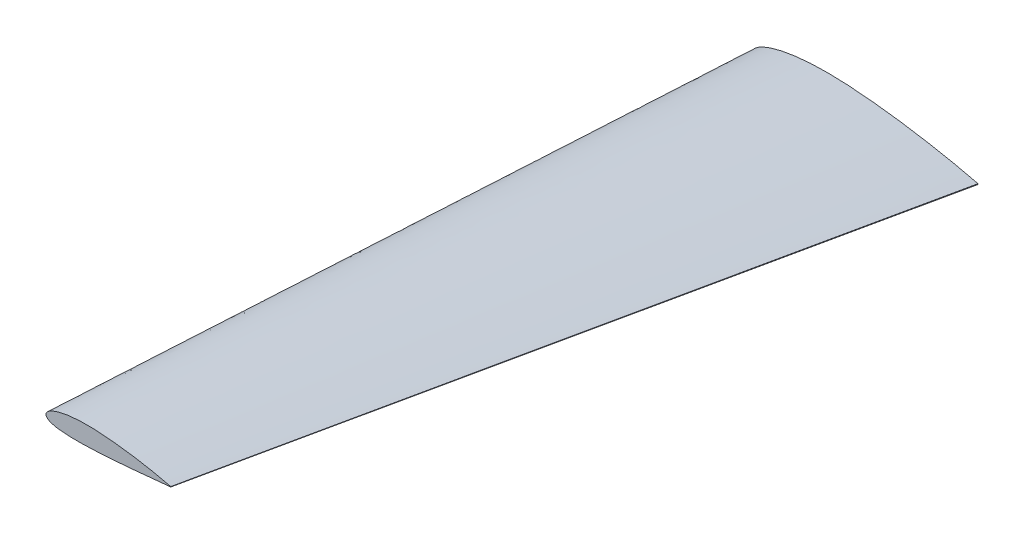
from build123d import *


with BuildPart() as part:
    # 1st airfoil → Loft2 section 0
    with BuildSketch(Plane.XY):
        with BuildLine():
            Line((1125.6, -0.909113568), (1125.6, -4.443091626))
            add(Edge.make_bspline(
                [(1125.6, -0.909113568), (1124.624936017, -0.660123834), (1120.62058284, 0.362417095), (1111.569252242, 2.505892261), (1096.550232752, 6.122404163), (1075.721387403, 10.965034412), (1049.309471361, 16.939316357), (1017.589841857, 23.876555702), (980.879432728, 31.523483854), (939.57587159, 39.738235439), (894.106329061, 48.253780275), (844.962049596, 56.883219356), (792.663181964, 65.38206179), (737.779875794, 73.55203211), (680.910182361, 81.166099133), (622.679833451, 88.004690437), (563.728429075, 93.887426627), (504.692395813, 98.561060411), (446.063199303, 101.961134933), (388.479078604, 103.549368042), (332.635559806, 103.11330405), (279.366346507, 100.626480887), (229.31295313, 96.166374749), (183.064756493, 89.803133409), (141.155847984, 81.769253747), (104.068602802, 72.2411645), (72.181897097, 61.558540548), (45.829346012, 49.93955445), (25.173564969, 37.690244008), (10.308778563, 24.94526832), (1.222733541, 11.491620122), (-1.022178786, -2.79241528), (4.007920171, -16.31516538), (15.408907008, -27.740831572), (32.187893722, -37.449608005), (54.309219424, -45.787931347), (81.638708838, -52.767249623), (113.938487706, -58.366325567), (150.884327322, -62.541572904), (192.096058356, -65.334420876), (237.152563597, -66.793342351), (285.607958385, -67.034221669), (336.977889113, -66.194115953), (390.753987563, -64.45804455), (446.578975057, -62.068229157), (503.890562489, -59.08726048), (562.074842401, -55.3454901), (620.33424818, -51.125842776), (678.030294929, -46.568607181), (734.532825698, -41.830786011), (789.227081447, -37.08318905), (841.506144564, -32.360371722), (890.794379398, -27.813553826), (936.539972629, -23.48333636), (978.226662529, -19.457033232), (1015.37920935, -15.809907167), (1047.574046904, -12.567814373), (1074.441639775, -9.810101231), (1095.674563553, -7.598624963), (1111.018994368, -5.993945559), (1120.335636801, -4.989664738), (1124.519509654, -4.55527366), (1125.6, -4.443091626)],
                knots=[0, 0, 0, 0, 0.001303345, 0.005352522, 0.012046339, 0.021311094, 0.033047622, 0.047117215, 0.063362508, 0.081612115, 0.101657457, 0.123273921, 0.14623252, 0.170277757, 0.195135791, 0.22054026, 0.24620839, 0.271859818, 0.29723365, 0.322260275, 0.346452958, 0.369543631, 0.391307276, 0.411513241, 0.429980367, 0.446542667, 0.461070389, 0.473485742, 0.483779539, 0.492063936, 0.498681588, 0.504376593, 0.510069863, 0.516664638, 0.524877655, 0.535024569, 0.547190471, 0.561360064, 0.577448521, 0.59532385, 0.614843137, 0.635823686, 0.658074561, 0.68137887, 0.705504986, 0.730440424, 0.755703478, 0.781015275, 0.806090941, 0.83065955, 0.854449961, 0.877193251, 0.898643274, 0.918555547, 0.936704445, 0.952884106, 0.96690411, 0.978611738, 0.98786388, 0.994552223, 0.998593105, 1, 1, 1, 1], degree=3))
        make_face()
    # Sketch5 → Loft2 section 1
    with BuildSketch(Plane.XY.offset(3643.731)):
        with BuildLine():
            Line((745.178038041, 323.07390356), (745.178038041, 321.12062717))
            add(Edge.make_bspline(
                [(745.178038041, 323.07390356), (744.639107288, 323.211523477), (742.425848351, 323.776695367), (737.423058275, 324.961422427), (729.121847656, 326.960316364), (717.609469483, 329.63690212), (703.011254331, 332.938966729), (685.479395783, 336.773270622), (665.18906736, 340.999828902), (642.360043101, 345.540230698), (617.228425856, 350.246884901), (590.065732927, 355.016489959), (561.159457416, 359.713912524), (530.82472856, 364.229563124), (499.392097204, 368.437958623), (467.207413578, 372.21773844), (434.624193065, 375.4692045), (401.994197047, 378.052383676), (369.58906508, 379.931649812), (337.76156033, 380.809487247), (306.896109261, 380.568468914), (277.453510872, 379.193968877), (249.788338666, 376.728809253), (224.226349001, 373.211761645), (201.062741248, 368.771330151), (180.564130557, 363.505029266), (162.939926784, 357.600601788), (148.374523428, 351.178634573), (136.957800185, 344.408278761), (128.741836231, 337.363962214), (123.719859034, 329.927953004), (122.479066314, 322.032977807), (125.259268503, 314.558775061), (131.560744644, 308.243658314), (140.834712413, 302.877489233), (153.061461564, 298.268787693), (168.166831648, 294.411226218), (186.01934642, 291.316542926), (206.439800385, 289.008828527), (229.218068931, 287.465184533), (254.121395007, 286.658819347), (280.903332269, 286.525682164), (309.296172072, 286.990019699), (339.018932585, 287.949569314), (369.874141158, 289.270451874), (401.551013169, 290.918072669), (433.71023385, 292.986198622), (465.910977591, 295.318453481), (497.800345349, 297.837297839), (529.030041047, 300.455954232), (559.260279236, 303.080013833), (588.15560853, 305.690377405), (615.397867494, 308.203463763), (640.682061613, 310.5968322), (663.722846202, 312.822223165), (684.257549973, 314.838037955), (702.052062292, 316.629985501), (716.902136051, 318.154210011), (728.637853714, 319.376522179), (737.118923473, 320.263449699), (742.268354909, 320.818528985), (744.580836743, 321.058622676), (745.178038041, 321.12062717)],
                knots=[0, 0, 0, 0, 0.001303345, 0.005352522, 0.012046339, 0.021311094, 0.033047622, 0.047117215, 0.063362508, 0.081612115, 0.101657457, 0.123273921, 0.14623252, 0.170277757, 0.195135791, 0.22054026, 0.24620839, 0.271859818, 0.29723365, 0.322260275, 0.346452958, 0.369543631, 0.391307276, 0.411513241, 0.429980367, 0.446542667, 0.461070389, 0.473485742, 0.483779539, 0.492063936, 0.498681588, 0.504376593, 0.510069863, 0.516664638, 0.524877655, 0.535024569, 0.547190471, 0.561360064, 0.577448521, 0.59532385, 0.614843137, 0.635823686, 0.658074561, 0.68137887, 0.705504986, 0.730440424, 0.755703478, 0.781015275, 0.806090941, 0.83065955, 0.854449961, 0.877193251, 0.898643274, 0.918555547, 0.936704445, 0.952884106, 0.96690411, 0.978611738, 0.98786388, 0.994552223, 0.998593105, 1, 1, 1, 1], degree=3))
        make_face()
    loft()


solid = part.part
